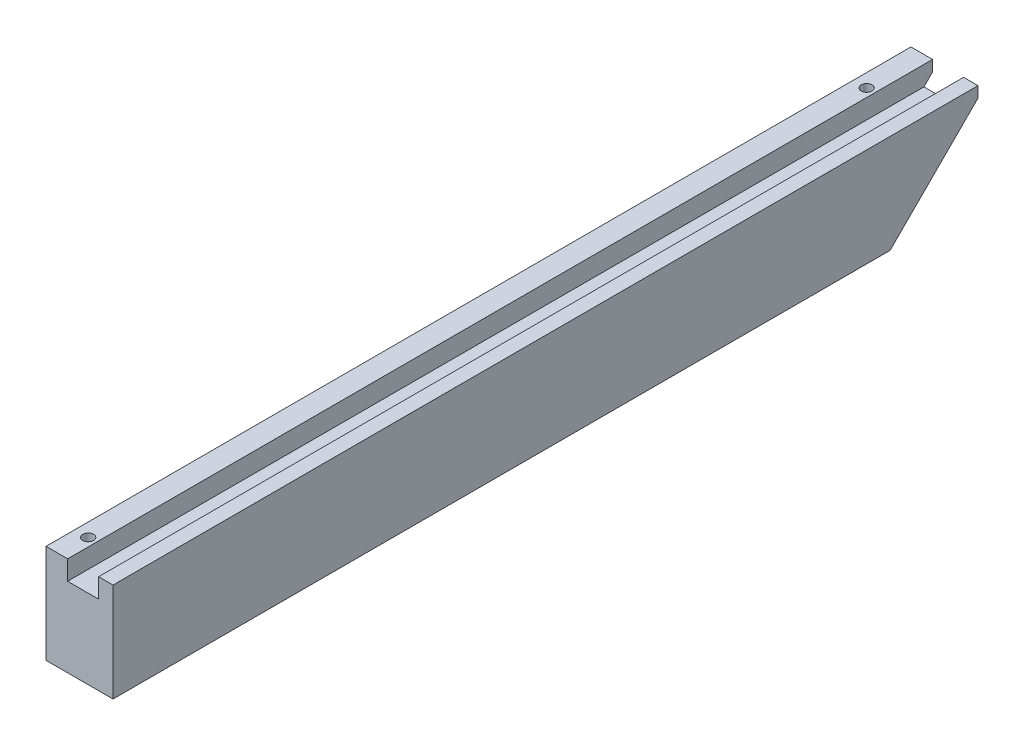
from build123d import *

# Parameters (mm, degrees)
RAIL_EXTRUDE_DEPTH = 120
SKETCH2_R          = 0.75
FIRST_HOLE_DEPTH   = 123.01094685
SKETCH3_R          = 0.75
LAST_HOLE_DEPTH    = 123.01094685
ANGLE_DEPTH        = 121.588422338


with BuildPart() as part:
    # Sketch1 → Rail-Extrude (new body)
    with BuildSketch(Plane.XY):
        Polygon((7.991071429, 6.278571429), (10.991071429, 6.278571429), (10.991071429, 3.578571429), (15.291071429, 3.578571429), (15.291071429, 6.278571429), (17.291071429, 6.278571429), (17.291071429, -7.421428571), (7.991071429, -7.421428571), align=None)
    extrude(amount=RAIL_EXTRUDE_DEPTH)

    # Sketch2 → First Hole (cut, through all)
    with BuildSketch(Plane(origin=(0, 6.278571429, 0), x_dir=(1, 0, 0), z_dir=(0, 1, 0))):
        with Locations((9.841071429, -8)):
            Circle(SKETCH2_R)
    extrude(amount=-FIRST_HOLE_DEPTH, mode=Mode.SUBTRACT)

    # Sketch3 → Last Hole (cut, through all)
    with BuildSketch(Plane(origin=(0, 6.278571429, 0), x_dir=(1, 0, 0), z_dir=(0, 1, 0))):
        with Locations((9.841071429, -116)):
            Circle(SKETCH3_R)
    extrude(amount=-LAST_HOLE_DEPTH, mode=Mode.SUBTRACT)

    # Sketch5 → Angle (cut, through all)
    with BuildSketch(Plane.ZY.offset(-7.991071429)):
        Polygon((12.2, -7.421428571), (0, 4.778571429), (0, -7.421428571), align=None)
    extrude(amount=-ANGLE_DEPTH, mode=Mode.SUBTRACT)


solid = part.part
